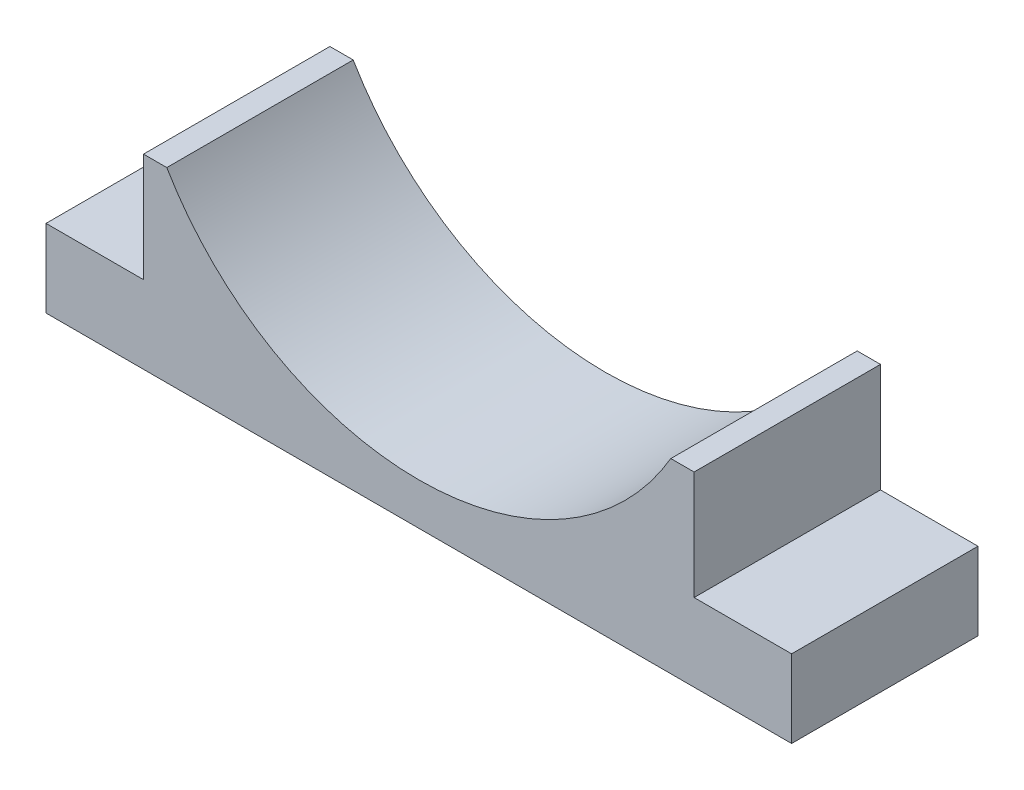
from build123d import *

# Parameters (mm, degrees)
CYLINDRICAL_MOTOR_SEAT_DEPTH = 12


with BuildPart() as part:
    # Cylindrical motor seat profile → Cylindrical motor seat (new body)
    with BuildSketch(Plane.XY):
        with BuildLine():
            Line((-24, 7), (24, 7))
            Line((24, 7), (24, 12))
            Line((24, 12), (17.723131634, 12))
            Line((17.723131634, 12), (17.723131634, 19))
            Line((17.723131634, 19), (16.223131634, 19))
            ThreePointArc((16.223131634, 19), (0, 9.7), (-16.223131634, 19))
            Line((-16.223131634, 19), (-17.723131634, 19))
            Line((-17.723131634, 19), (-17.723131634, 12))
            Line((-17.723131634, 12), (-24, 12))
            Line((-24, 12), (-24, 7))
        make_face()
    extrude(amount=CYLINDRICAL_MOTOR_SEAT_DEPTH)


solid = part.part
